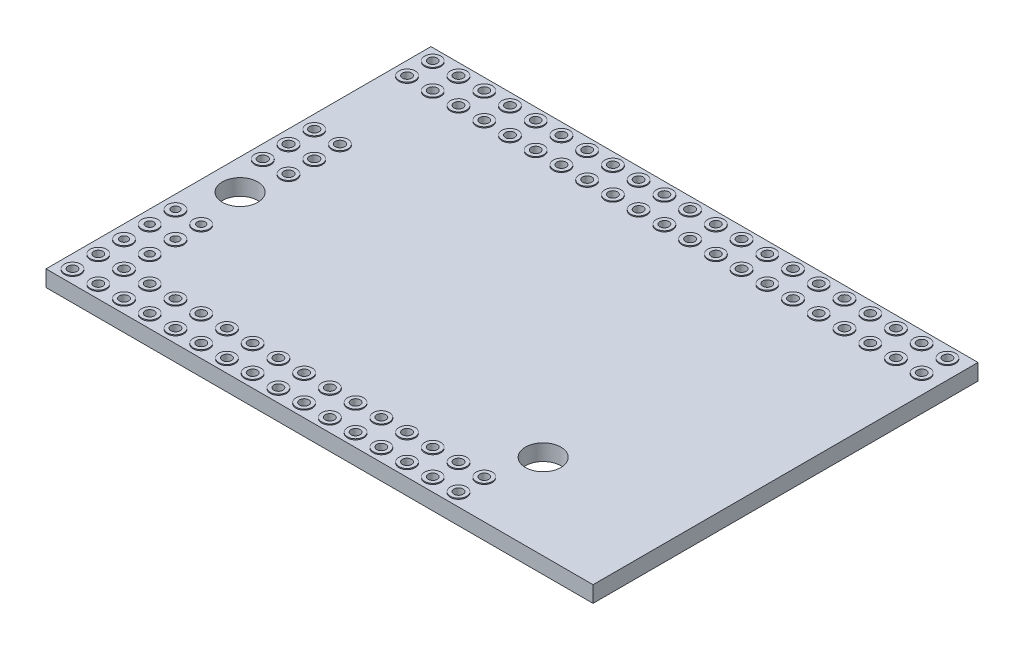
from build123d import *

# Parameters (mm, degrees)
SKETCH1_W                = 54
SKETCH1_H                = 38
BOSS_EXTRUDE1_DEPTH      = 1.6
SKETCH2_R                = 0.45
SKETCH2_R_2              = 0.394522512
SKETCH2_R_3              = 0.464048526
CUT_EXTRUDE1_DEPTH       = 34.053895383
SKETCH3_R                = 1.75
CUT_EXTRUDE2_DEPTH       = 34.053895383
BOSS_EXTRUDE2_DEPTH      = 0.1
BOSS_EXTRUDE2_DEPTH_BACK = 1.7
SKETCH4_R                = 0.8
SKETCH4_R_2              = 0.45
SKETCH4_R_3              = 0.464048526
SKETCH4_R_4              = 0.394522512


with BuildPart() as part:
    # Sketch1 → Boss-Extrude1 (new body)
    with BuildSketch(Plane(origin=(0, 0, 0), x_dir=(1, 0, 0), z_dir=(0, 1, 0))):
        Rectangle(SKETCH1_W, SKETCH1_H)
    extrude(amount=BOSS_EXTRUDE1_DEPTH)

    # Sketch2 → Cut-Extrude1 (cut, through all)
    with BuildSketch(Plane(origin=(0, 1.6, 0), x_dir=(1, 0, 0), z_dir=(0, 1, 0))):
        with Locations(Location((-25.6, -17.78, 0), (0, 0, 270))):
            Circle(SKETCH2_R)
        with Locations(Location((-23.06, -17.78, 0), (0, 0, 270))):
            Circle(SKETCH2_R)
        with Locations(Location((-20.52, -17.78, 0), (0, 0, 270))):
            Circle(SKETCH2_R)
        with Locations(Location((-17.98, -17.78, 0), (0, 0, 270))):
            Circle(SKETCH2_R)
        with Locations(Location((-15.44, -17.78, 0), (0, 0, 270))):
            Circle(SKETCH2_R)
        with Locations(Location((-12.9, -17.78, 0), (0, 0, 270))):
            Circle(SKETCH2_R)
        with Locations(Location((-10.36, -17.78, 0), (0, 0, 270))):
            Circle(SKETCH2_R)
        with Locations(Location((-7.82, -17.78, 0), (0, 0, 270))):
            Circle(SKETCH2_R)
        with Locations(Location((-5.28, -17.78, 0), (0, 0, 270))):
            Circle(SKETCH2_R)
        with Locations(Location((-2.74, -17.78, 0), (0, 0, 270))):
            Circle(SKETCH2_R)
        with Locations(Location((-0.2, -17.78, 0), (0, 0, 270))):
            Circle(SKETCH2_R)
        with Locations(Location((2.34, -17.78, 0), (0, 0, 270))):
            Circle(SKETCH2_R)
        with Locations(Location((4.88, -17.78, 0), (0, 0, 270))):
            Circle(SKETCH2_R)
        with Locations(Location((7.42, -17.78, 0), (0, 0, 270))):
            Circle(SKETCH2_R)
        with Locations(Location((9.96, -17.78, 0), (0, 0, 270))):
            Circle(SKETCH2_R)
        with Locations(Location((12.5, -17.78, 0), (0, 0, 270))):
            Circle(SKETCH2_R)
        with Locations(Location((-23.06, -15.24, 0), (0, 0, 270))):
            Circle(SKETCH2_R)
        with Locations(Location((-20.52, -15.24, 0), (0, 0, 270))):
            Circle(SKETCH2_R)
        with Locations(Location((-17.98, -15.24, 0), (0, 0, 270))):
            Circle(SKETCH2_R)
        with Locations(Location((-15.44, -15.24, 0), (0, 0, 270))):
            Circle(SKETCH2_R)
        with Locations(Location((-12.9, -15.24, 0), (0, 0, 270))):
            Circle(SKETCH2_R)
        with Locations(Location((-10.36, -15.24, 0), (0, 0, 270))):
            Circle(SKETCH2_R)
        with Locations(Location((-7.82, -15.24, 0), (0, 0, 270))):
            Circle(SKETCH2_R)
        with Locations(Location((-5.28, -15.24, 0), (0, 0, 270))):
            Circle(SKETCH2_R)
        with Locations(Location((-2.74, -15.24, 0), (0, 0, 270))):
            Circle(SKETCH2_R)
        with Locations(Location((-0.2, -15.24, 0), (0, 0, 270))):
            Circle(SKETCH2_R)
        with Locations(Location((2.34, -15.24, 0), (0, 0, 270))):
            Circle(SKETCH2_R)
        with Locations(Location((4.88, -15.24, 0), (0, 0, 270))):
            Circle(SKETCH2_R)
        with Locations(Location((7.42, -15.24, 0), (0, 0, 270))):
            Circle(SKETCH2_R)
        with Locations(Location((9.96, -15.24, 0), (0, 0, 270))):
            Circle(SKETCH2_R)
        with Locations(Location((12.5, -15.24, 0), (0, 0, 270))):
            Circle(SKETCH2_R)
        with Locations(Location((-25.6, -15.24, 0), (0, 0, 270))):
            Circle(SKETCH2_R)
        with Locations(Location((-25.6, 17.78, 0), (0, 0, 270))):
            Circle(SKETCH2_R)
        with Locations(Location((-23.06, 17.78, 0), (0, 0, 270))):
            Circle(SKETCH2_R)
        with Locations(Location((-20.52, 17.78, 0), (0, 0, 270))):
            Circle(SKETCH2_R)
        with Locations(Location((-17.98, 17.78, 0), (0, 0, 270))):
            Circle(SKETCH2_R)
        with Locations(Location((-15.44, 17.78, 0), (0, 0, 270))):
            Circle(SKETCH2_R)
        with Locations(Location((-12.9, 17.78, 0), (0, 0, 270))):
            Circle(SKETCH2_R)
        with Locations(Location((-10.36, 17.78, 0), (0, 0, 270))):
            Circle(SKETCH2_R)
        with Locations(Location((-7.82, 17.78, 0), (0, 0, 270))):
            Circle(SKETCH2_R)
        with Locations(Location((-5.28, 17.78, 0), (0, 0, 270))):
            Circle(SKETCH2_R)
        with Locations(Location((-2.74, 17.78, 0), (0, 0, 270))):
            Circle(SKETCH2_R)
        with Locations(Location((-0.2, 17.78, 0), (0, 0, 270))):
            Circle(SKETCH2_R)
        with Locations(Location((2.34, 17.78, 0), (0, 0, 270))):
            Circle(SKETCH2_R)
        with Locations(Location((4.88, 17.78, 0), (0, 0, 270))):
            Circle(SKETCH2_R)
        with Locations(Location((7.42, 17.78, 0), (0, 0, 270))):
            Circle(SKETCH2_R)
        with Locations(Location((9.96, 17.78, 0), (0, 0, 270))):
            Circle(SKETCH2_R)
        with Locations(Location((12.5, 17.78, 0), (0, 0, 270))):
            Circle(SKETCH2_R)
        with Locations(Location((15.04, 17.78, 0), (0, 0, 270))):
            Circle(SKETCH2_R)
        with Locations(Location((17.58, 17.78, 0), (0, 0, 270))):
            Circle(SKETCH2_R)
        with Locations(Location((20.12, 17.78, 0), (0, 0, 270))):
            Circle(SKETCH2_R)
        with Locations(Location((22.66, 17.78, 0), (0, 0, 270))):
            Circle(SKETCH2_R)
        with Locations(Location((25.2, 17.78, 0), (0, 0, 270))):
            Circle(SKETCH2_R)
        with Locations(Location((-23.06, 15.24, 0), (0, 0, 270))):
            Circle(SKETCH2_R)
        with Locations(Location((-20.52, 15.24, 0), (0, 0, 270))):
            Circle(SKETCH2_R)
        with Locations(Location((-17.98, 15.24, 0), (0, 0, 270))):
            Circle(SKETCH2_R)
        with Locations(Location((-15.44, 15.24, 0), (0, 0, 270))):
            Circle(SKETCH2_R)
        with Locations(Location((-12.9, 15.24, 0), (0, 0, 270))):
            Circle(SKETCH2_R)
        with Locations(Location((-10.36, 15.24, 0), (0, 0, 270))):
            Circle(SKETCH2_R)
        with Locations(Location((-7.82, 15.24, 0), (0, 0, 270))):
            Circle(SKETCH2_R)
        with Locations(Location((-5.28, 15.24, 0), (0, 0, 270))):
            Circle(SKETCH2_R)
        with Locations(Location((-2.74, 15.24, 0), (0, 0, 270))):
            Circle(SKETCH2_R)
        with Locations(Location((-0.2, 15.24, 0), (0, 0, 270))):
            Circle(SKETCH2_R)
        with Locations(Location((2.34, 15.24, 0), (0, 0, 270))):
            Circle(SKETCH2_R)
        with Locations(Location((4.88, 15.24, 0), (0, 0, 270))):
            Circle(SKETCH2_R)
        with Locations(Location((7.42, 15.24, 0), (0, 0, 270))):
            Circle(SKETCH2_R)
        with Locations(Location((9.96, 15.24, 0), (0, 0, 270))):
            Circle(SKETCH2_R)
        with Locations(Location((12.5, 15.24, 0), (0, 0, 270))):
            Circle(SKETCH2_R)
        with Locations(Location((15.04, 15.24, 0), (0, 0, 270))):
            Circle(SKETCH2_R)
        with Locations(Location((17.58, 15.24, 0), (0, 0, 270))):
            Circle(SKETCH2_R)
        with Locations(Location((20.12, 15.24, 0), (0, 0, 270))):
            Circle(SKETCH2_R)
        with Locations(Location((22.66, 15.24, 0), (0, 0, 270))):
            Circle(SKETCH2_R)
        with Locations(Location((25.2, 15.24, 0), (0, 0, 270))):
            Circle(SKETCH2_R)
        with Locations(Location((-25.6, 15.24, 0), (0, 0, 270))):
            Circle(SKETCH2_R)
        with Locations(Location((-25.6, -12.7, 0), (0, 0, 270))):
            Circle(SKETCH2_R_2)
        with Locations(Location((-23.06, -12.7, 0), (0, 0, 270))):
            Circle(SKETCH2_R_2)
        with Locations(Location((-23.06, -10.16, 0), (0, 0, 270))):
            Circle(SKETCH2_R_2)
        with Locations(Location((-23.06, -7.62, 0), (0, 0, 270))):
            Circle(SKETCH2_R_2)
        with Locations(Location((-25.6, -10.16, 0), (0, 0, 270))):
            Circle(SKETCH2_R_2)
        with Locations(Location((-25.6, -7.62, 0), (0, 0, 270))):
            Circle(SKETCH2_R_2)
        with Locations(Location((-25.6, 1, 0), (0, 0, 270))):
            Circle(SKETCH2_R_3)
        with Locations(Location((-23.06, 1, 0), (0, 0, 270))):
            Circle(SKETCH2_R_3)
        with Locations(Location((-23.06, 3.54, 0), (0, 0, 270))):
            Circle(SKETCH2_R_3)
        with Locations(Location((-23.06, 6.08, 0), (0, 0, 270))):
            Circle(SKETCH2_R_3)
        with Locations(Location((-25.6, 3.54, 0), (0, 0, 270))):
            Circle(SKETCH2_R_3)
        with Locations(Location((-25.6, 6.08, 0), (0, 0, 270))):
            Circle(SKETCH2_R_3)
    extrude(amount=-CUT_EXTRUDE1_DEPTH, mode=Mode.SUBTRACT)

    # Sketch3 → Cut-Extrude2 (cut, through all)
    with BuildSketch(Plane(origin=(0, 1.6, 0), x_dir=(1, 0, 0), z_dir=(0, 1, 0))):
        with Locations(Location((-23.98400997, -2.856152335, 0), (0, 0, 270))):
            Circle(SKETCH3_R)
        with Locations(Location((13.646874832, -10.571837349, 0), (0, 0, 270))):
            Circle(SKETCH3_R)
    extrude(amount=-CUT_EXTRUDE2_DEPTH, mode=Mode.SUBTRACT)

    # Sketch4 → Boss-Extrude2 (add, two sides: drawn at the far end of the back side and taken through both)
    # profile 1 of 86: a face of its own
    with BuildSketch(Plane(origin=(0, 1.6, 0), x_dir=(1, 0, 0), z_dir=(0, 1, 0)).offset(-BOSS_EXTRUDE2_DEPTH_BACK)):
        with Locations(Location((-25.6, 17.78, 0), (0, 0, 270))):
            Circle(SKETCH4_R)
        with Locations(Location((-25.6, 17.78, 0), (0, 0, 270))):
            Circle(SKETCH4_R_2, mode=Mode.SUBTRACT)
    # profile 2 of 86: a face of its own
    with BuildSketch(Plane(origin=(0, 1.6, 0), x_dir=(1, 0, 0), z_dir=(0, 1, 0)).offset(-BOSS_EXTRUDE2_DEPTH_BACK)):
        with Locations(Location((-23.06, 17.78, 0), (0, 0, 270))):
            Circle(SKETCH4_R)
        with Locations(Location((-23.06, 17.78, 0), (0, 0, 270))):
            Circle(SKETCH4_R_2, mode=Mode.SUBTRACT)
    # profile 3 of 86: a face of its own
    with BuildSketch(Plane(origin=(0, 1.6, 0), x_dir=(1, 0, 0), z_dir=(0, 1, 0)).offset(-BOSS_EXTRUDE2_DEPTH_BACK)):
        with Locations(Location((-20.52, 17.78, 0), (0, 0, 270))):
            Circle(SKETCH4_R)
        with Locations(Location((-20.52, 17.78, 0), (0, 0, 270))):
            Circle(SKETCH4_R_2, mode=Mode.SUBTRACT)
    # profile 4 of 86: a face of its own
    with BuildSketch(Plane(origin=(0, 1.6, 0), x_dir=(1, 0, 0), z_dir=(0, 1, 0)).offset(-BOSS_EXTRUDE2_DEPTH_BACK)):
        with Locations(Location((-17.98, 17.78, 0), (0, 0, 270))):
            Circle(SKETCH4_R)
        with Locations(Location((-17.98, 17.78, 0), (0, 0, 270))):
            Circle(SKETCH4_R_2, mode=Mode.SUBTRACT)
    # profile 5 of 86: a face of its own
    with BuildSketch(Plane(origin=(0, 1.6, 0), x_dir=(1, 0, 0), z_dir=(0, 1, 0)).offset(-BOSS_EXTRUDE2_DEPTH_BACK)):
        with Locations(Location((-15.44, 17.78, 0), (0, 0, 270))):
            Circle(SKETCH4_R)
        with Locations(Location((-15.44, 17.78, 0), (0, 0, 270))):
            Circle(SKETCH4_R_2, mode=Mode.SUBTRACT)
    # profile 6 of 86: a face of its own
    with BuildSketch(Plane(origin=(0, 1.6, 0), x_dir=(1, 0, 0), z_dir=(0, 1, 0)).offset(-BOSS_EXTRUDE2_DEPTH_BACK)):
        with Locations(Location((-12.9, 17.78, 0), (0, 0, 270))):
            Circle(SKETCH4_R)
        with Locations(Location((-12.9, 17.78, 0), (0, 0, 270))):
            Circle(SKETCH4_R_2, mode=Mode.SUBTRACT)
    # profile 7 of 86: a face of its own
    with BuildSketch(Plane(origin=(0, 1.6, 0), x_dir=(1, 0, 0), z_dir=(0, 1, 0)).offset(-BOSS_EXTRUDE2_DEPTH_BACK)):
        with Locations(Location((-10.36, 17.78, 0), (0, 0, 270))):
            Circle(SKETCH4_R)
        with Locations(Location((-10.36, 17.78, 0), (0, 0, 270))):
            Circle(SKETCH4_R_2, mode=Mode.SUBTRACT)
    # profile 8 of 86: a face of its own
    with BuildSketch(Plane(origin=(0, 1.6, 0), x_dir=(1, 0, 0), z_dir=(0, 1, 0)).offset(-BOSS_EXTRUDE2_DEPTH_BACK)):
        with Locations(Location((-7.82, 17.78, 0), (0, 0, 270))):
            Circle(SKETCH4_R)
        with Locations(Location((-7.82, 17.78, 0), (0, 0, 270))):
            Circle(SKETCH4_R_2, mode=Mode.SUBTRACT)
    # profile 9 of 86: a face of its own
    with BuildSketch(Plane(origin=(0, 1.6, 0), x_dir=(1, 0, 0), z_dir=(0, 1, 0)).offset(-BOSS_EXTRUDE2_DEPTH_BACK)):
        with Locations(Location((-5.28, 17.78, 0), (0, 0, 270))):
            Circle(SKETCH4_R)
        with Locations(Location((-5.28, 17.78, 0), (0, 0, 270))):
            Circle(SKETCH4_R_2, mode=Mode.SUBTRACT)
    # profile 10 of 86: a face of its own
    with BuildSketch(Plane(origin=(0, 1.6, 0), x_dir=(1, 0, 0), z_dir=(0, 1, 0)).offset(-BOSS_EXTRUDE2_DEPTH_BACK)):
        with Locations(Location((-2.74, 17.78, 0), (0, 0, 270))):
            Circle(SKETCH4_R)
        with Locations(Location((-2.74, 17.78, 0), (0, 0, 270))):
            Circle(SKETCH4_R_2, mode=Mode.SUBTRACT)
    # profile 11 of 86: a face of its own
    with BuildSketch(Plane(origin=(0, 1.6, 0), x_dir=(1, 0, 0), z_dir=(0, 1, 0)).offset(-BOSS_EXTRUDE2_DEPTH_BACK)):
        with Locations(Location((-0.2, 17.78, 0), (0, 0, 270))):
            Circle(SKETCH4_R)
        with Locations(Location((-0.2, 17.78, 0), (0, 0, 270))):
            Circle(SKETCH4_R_2, mode=Mode.SUBTRACT)
    # profile 12 of 86: a face of its own
    with BuildSketch(Plane(origin=(0, 1.6, 0), x_dir=(1, 0, 0), z_dir=(0, 1, 0)).offset(-BOSS_EXTRUDE2_DEPTH_BACK)):
        with Locations(Location((2.34, 17.78, 0), (0, 0, 270))):
            Circle(SKETCH4_R)
        with Locations(Location((2.34, 17.78, 0), (0, 0, 270))):
            Circle(SKETCH4_R_2, mode=Mode.SUBTRACT)
    # profile 13 of 86: a face of its own
    with BuildSketch(Plane(origin=(0, 1.6, 0), x_dir=(1, 0, 0), z_dir=(0, 1, 0)).offset(-BOSS_EXTRUDE2_DEPTH_BACK)):
        with Locations(Location((4.88, 17.78, 0), (0, 0, 270))):
            Circle(SKETCH4_R)
        with Locations(Location((4.88, 17.78, 0), (0, 0, 270))):
            Circle(SKETCH4_R_2, mode=Mode.SUBTRACT)
    # profile 14 of 86: a face of its own
    with BuildSketch(Plane(origin=(0, 1.6, 0), x_dir=(1, 0, 0), z_dir=(0, 1, 0)).offset(-BOSS_EXTRUDE2_DEPTH_BACK)):
        with Locations(Location((7.42, 17.78, 0), (0, 0, 270))):
            Circle(SKETCH4_R)
        with Locations(Location((7.42, 17.78, 0), (0, 0, 270))):
            Circle(SKETCH4_R_2, mode=Mode.SUBTRACT)
    # profile 15 of 86: a face of its own
    with BuildSketch(Plane(origin=(0, 1.6, 0), x_dir=(1, 0, 0), z_dir=(0, 1, 0)).offset(-BOSS_EXTRUDE2_DEPTH_BACK)):
        with Locations(Location((9.96, 17.78, 0), (0, 0, 270))):
            Circle(SKETCH4_R)
        with Locations(Location((9.96, 17.78, 0), (0, 0, 270))):
            Circle(SKETCH4_R_2, mode=Mode.SUBTRACT)
    # profile 16 of 86: a face of its own
    with BuildSketch(Plane(origin=(0, 1.6, 0), x_dir=(1, 0, 0), z_dir=(0, 1, 0)).offset(-BOSS_EXTRUDE2_DEPTH_BACK)):
        with Locations(Location((12.5, 17.78, 0), (0, 0, 270))):
            Circle(SKETCH4_R)
        with Locations(Location((12.5, 17.78, 0), (0, 0, 270))):
            Circle(SKETCH4_R_2, mode=Mode.SUBTRACT)
    # profile 17 of 86: a face of its own
    with BuildSketch(Plane(origin=(0, 1.6, 0), x_dir=(1, 0, 0), z_dir=(0, 1, 0)).offset(-BOSS_EXTRUDE2_DEPTH_BACK)):
        with Locations(Location((15.04, 17.78, 0), (0, 0, 270))):
            Circle(SKETCH4_R)
        with Locations(Location((15.04, 17.78, 0), (0, 0, 270))):
            Circle(SKETCH4_R_2, mode=Mode.SUBTRACT)
    # profile 18 of 86: a face of its own
    with BuildSketch(Plane(origin=(0, 1.6, 0), x_dir=(1, 0, 0), z_dir=(0, 1, 0)).offset(-BOSS_EXTRUDE2_DEPTH_BACK)):
        with Locations(Location((17.58, 17.78, 0), (0, 0, 270))):
            Circle(SKETCH4_R)
        with Locations(Location((17.58, 17.78, 0), (0, 0, 270))):
            Circle(SKETCH4_R_2, mode=Mode.SUBTRACT)
    # profile 19 of 86: a face of its own
    with BuildSketch(Plane(origin=(0, 1.6, 0), x_dir=(1, 0, 0), z_dir=(0, 1, 0)).offset(-BOSS_EXTRUDE2_DEPTH_BACK)):
        with Locations(Location((20.12, 17.78, 0), (0, 0, 270))):
            Circle(SKETCH4_R)
        with Locations(Location((20.12, 17.78, 0), (0, 0, 270))):
            Circle(SKETCH4_R_2, mode=Mode.SUBTRACT)
    # profile 20 of 86: a face of its own
    with BuildSketch(Plane(origin=(0, 1.6, 0), x_dir=(1, 0, 0), z_dir=(0, 1, 0)).offset(-BOSS_EXTRUDE2_DEPTH_BACK)):
        with Locations(Location((22.66, 17.78, 0), (0, 0, 270))):
            Circle(SKETCH4_R)
        with Locations(Location((22.66, 17.78, 0), (0, 0, 270))):
            Circle(SKETCH4_R_2, mode=Mode.SUBTRACT)
    # profile 21 of 86: a face of its own
    with BuildSketch(Plane(origin=(0, 1.6, 0), x_dir=(1, 0, 0), z_dir=(0, 1, 0)).offset(-BOSS_EXTRUDE2_DEPTH_BACK)):
        with Locations(Location((25.2, 17.78, 0), (0, 0, 270))):
            Circle(SKETCH4_R)
        with Locations(Location((25.2, 17.78, 0), (0, 0, 270))):
            Circle(SKETCH4_R_2, mode=Mode.SUBTRACT)
    # profile 22 of 86: a face of its own
    with BuildSketch(Plane(origin=(0, 1.6, 0), x_dir=(1, 0, 0), z_dir=(0, 1, 0)).offset(-BOSS_EXTRUDE2_DEPTH_BACK)):
        with Locations(Location((-23.06, 15.24, 0), (0, 0, 270))):
            Circle(SKETCH4_R)
        with Locations(Location((-23.06, 15.24, 0), (0, 0, 270))):
            Circle(SKETCH4_R_2, mode=Mode.SUBTRACT)
    # profile 23 of 86: a face of its own
    with BuildSketch(Plane(origin=(0, 1.6, 0), x_dir=(1, 0, 0), z_dir=(0, 1, 0)).offset(-BOSS_EXTRUDE2_DEPTH_BACK)):
        with Locations(Location((-20.52, 15.24, 0), (0, 0, 270))):
            Circle(SKETCH4_R)
        with Locations(Location((-20.52, 15.24, 0), (0, 0, 270))):
            Circle(SKETCH4_R_2, mode=Mode.SUBTRACT)
    # profile 24 of 86: a face of its own
    with BuildSketch(Plane(origin=(0, 1.6, 0), x_dir=(1, 0, 0), z_dir=(0, 1, 0)).offset(-BOSS_EXTRUDE2_DEPTH_BACK)):
        with Locations(Location((-17.98, 15.24, 0), (0, 0, 270))):
            Circle(SKETCH4_R)
        with Locations(Location((-17.98, 15.24, 0), (0, 0, 270))):
            Circle(SKETCH4_R_2, mode=Mode.SUBTRACT)
    # profile 25 of 86: a face of its own
    with BuildSketch(Plane(origin=(0, 1.6, 0), x_dir=(1, 0, 0), z_dir=(0, 1, 0)).offset(-BOSS_EXTRUDE2_DEPTH_BACK)):
        with Locations(Location((-15.44, 15.24, 0), (0, 0, 270))):
            Circle(SKETCH4_R)
        with Locations(Location((-15.44, 15.24, 0), (0, 0, 270))):
            Circle(SKETCH4_R_2, mode=Mode.SUBTRACT)
    # profile 26 of 86: a face of its own
    with BuildSketch(Plane(origin=(0, 1.6, 0), x_dir=(1, 0, 0), z_dir=(0, 1, 0)).offset(-BOSS_EXTRUDE2_DEPTH_BACK)):
        with Locations(Location((-12.9, 15.24, 0), (0, 0, 270))):
            Circle(SKETCH4_R)
        with Locations(Location((-12.9, 15.24, 0), (0, 0, 270))):
            Circle(SKETCH4_R_2, mode=Mode.SUBTRACT)
    # profile 27 of 86: a face of its own
    with BuildSketch(Plane(origin=(0, 1.6, 0), x_dir=(1, 0, 0), z_dir=(0, 1, 0)).offset(-BOSS_EXTRUDE2_DEPTH_BACK)):
        with Locations(Location((-10.36, 15.24, 0), (0, 0, 270))):
            Circle(SKETCH4_R)
        with Locations(Location((-10.36, 15.24, 0), (0, 0, 270))):
            Circle(SKETCH4_R_2, mode=Mode.SUBTRACT)
    # profile 28 of 86: a face of its own
    with BuildSketch(Plane(origin=(0, 1.6, 0), x_dir=(1, 0, 0), z_dir=(0, 1, 0)).offset(-BOSS_EXTRUDE2_DEPTH_BACK)):
        with Locations(Location((-7.82, 15.24, 0), (0, 0, 270))):
            Circle(SKETCH4_R)
        with Locations(Location((-7.82, 15.24, 0), (0, 0, 270))):
            Circle(SKETCH4_R_2, mode=Mode.SUBTRACT)
    # profile 29 of 86: a face of its own
    with BuildSketch(Plane(origin=(0, 1.6, 0), x_dir=(1, 0, 0), z_dir=(0, 1, 0)).offset(-BOSS_EXTRUDE2_DEPTH_BACK)):
        with Locations(Location((-5.28, 15.24, 0), (0, 0, 270))):
            Circle(SKETCH4_R)
        with Locations(Location((-5.28, 15.24, 0), (0, 0, 270))):
            Circle(SKETCH4_R_2, mode=Mode.SUBTRACT)
    # profile 30 of 86: a face of its own
    with BuildSketch(Plane(origin=(0, 1.6, 0), x_dir=(1, 0, 0), z_dir=(0, 1, 0)).offset(-BOSS_EXTRUDE2_DEPTH_BACK)):
        with Locations(Location((-2.74, 15.24, 0), (0, 0, 270))):
            Circle(SKETCH4_R)
        with Locations(Location((-2.74, 15.24, 0), (0, 0, 270))):
            Circle(SKETCH4_R_2, mode=Mode.SUBTRACT)
    # profile 31 of 86: a face of its own
    with BuildSketch(Plane(origin=(0, 1.6, 0), x_dir=(1, 0, 0), z_dir=(0, 1, 0)).offset(-BOSS_EXTRUDE2_DEPTH_BACK)):
        with Locations(Location((-0.2, 15.24, 0), (0, 0, 270))):
            Circle(SKETCH4_R)
        with Locations(Location((-0.2, 15.24, 0), (0, 0, 270))):
            Circle(SKETCH4_R_2, mode=Mode.SUBTRACT)
    # profile 32 of 86: a face of its own
    with BuildSketch(Plane(origin=(0, 1.6, 0), x_dir=(1, 0, 0), z_dir=(0, 1, 0)).offset(-BOSS_EXTRUDE2_DEPTH_BACK)):
        with Locations(Location((2.34, 15.24, 0), (0, 0, 270))):
            Circle(SKETCH4_R)
        with Locations(Location((2.34, 15.24, 0), (0, 0, 270))):
            Circle(SKETCH4_R_2, mode=Mode.SUBTRACT)
    # profile 33 of 86: a face of its own
    with BuildSketch(Plane(origin=(0, 1.6, 0), x_dir=(1, 0, 0), z_dir=(0, 1, 0)).offset(-BOSS_EXTRUDE2_DEPTH_BACK)):
        with Locations(Location((4.88, 15.24, 0), (0, 0, 270))):
            Circle(SKETCH4_R)
        with Locations(Location((4.88, 15.24, 0), (0, 0, 270))):
            Circle(SKETCH4_R_2, mode=Mode.SUBTRACT)
    # profile 34 of 86: a face of its own
    with BuildSketch(Plane(origin=(0, 1.6, 0), x_dir=(1, 0, 0), z_dir=(0, 1, 0)).offset(-BOSS_EXTRUDE2_DEPTH_BACK)):
        with Locations(Location((7.42, 15.24, 0), (0, 0, 270))):
            Circle(SKETCH4_R)
        with Locations(Location((7.42, 15.24, 0), (0, 0, 270))):
            Circle(SKETCH4_R_2, mode=Mode.SUBTRACT)
    # profile 35 of 86: a face of its own
    with BuildSketch(Plane(origin=(0, 1.6, 0), x_dir=(1, 0, 0), z_dir=(0, 1, 0)).offset(-BOSS_EXTRUDE2_DEPTH_BACK)):
        with Locations(Location((9.96, 15.24, 0), (0, 0, 270))):
            Circle(SKETCH4_R)
        with Locations(Location((9.96, 15.24, 0), (0, 0, 270))):
            Circle(SKETCH4_R_2, mode=Mode.SUBTRACT)
    # profile 36 of 86: a face of its own
    with BuildSketch(Plane(origin=(0, 1.6, 0), x_dir=(1, 0, 0), z_dir=(0, 1, 0)).offset(-BOSS_EXTRUDE2_DEPTH_BACK)):
        with Locations(Location((12.5, 15.24, 0), (0, 0, 270))):
            Circle(SKETCH4_R)
        with Locations(Location((12.5, 15.24, 0), (0, 0, 270))):
            Circle(SKETCH4_R_2, mode=Mode.SUBTRACT)
    # profile 37 of 86: a face of its own
    with BuildSketch(Plane(origin=(0, 1.6, 0), x_dir=(1, 0, 0), z_dir=(0, 1, 0)).offset(-BOSS_EXTRUDE2_DEPTH_BACK)):
        with Locations(Location((15.04, 15.24, 0), (0, 0, 270))):
            Circle(SKETCH4_R)
        with Locations(Location((15.04, 15.24, 0), (0, 0, 270))):
            Circle(SKETCH4_R_2, mode=Mode.SUBTRACT)
    # profile 38 of 86: a face of its own
    with BuildSketch(Plane(origin=(0, 1.6, 0), x_dir=(1, 0, 0), z_dir=(0, 1, 0)).offset(-BOSS_EXTRUDE2_DEPTH_BACK)):
        with Locations(Location((17.58, 15.24, 0), (0, 0, 270))):
            Circle(SKETCH4_R)
        with Locations(Location((17.58, 15.24, 0), (0, 0, 270))):
            Circle(SKETCH4_R_2, mode=Mode.SUBTRACT)
    # profile 39 of 86: a face of its own
    with BuildSketch(Plane(origin=(0, 1.6, 0), x_dir=(1, 0, 0), z_dir=(0, 1, 0)).offset(-BOSS_EXTRUDE2_DEPTH_BACK)):
        with Locations(Location((20.12, 15.24, 0), (0, 0, 270))):
            Circle(SKETCH4_R)
        with Locations(Location((20.12, 15.24, 0), (0, 0, 270))):
            Circle(SKETCH4_R_2, mode=Mode.SUBTRACT)
    # profile 40 of 86: a face of its own
    with BuildSketch(Plane(origin=(0, 1.6, 0), x_dir=(1, 0, 0), z_dir=(0, 1, 0)).offset(-BOSS_EXTRUDE2_DEPTH_BACK)):
        with Locations(Location((22.66, 15.24, 0), (0, 0, 270))):
            Circle(SKETCH4_R)
        with Locations(Location((22.66, 15.24, 0), (0, 0, 270))):
            Circle(SKETCH4_R_2, mode=Mode.SUBTRACT)
    # profile 41 of 86: a face of its own
    with BuildSketch(Plane(origin=(0, 1.6, 0), x_dir=(1, 0, 0), z_dir=(0, 1, 0)).offset(-BOSS_EXTRUDE2_DEPTH_BACK)):
        with Locations(Location((25.2, 15.24, 0), (0, 0, 270))):
            Circle(SKETCH4_R)
        with Locations(Location((25.2, 15.24, 0), (0, 0, 270))):
            Circle(SKETCH4_R_2, mode=Mode.SUBTRACT)
    # profile 42 of 86: a face of its own
    with BuildSketch(Plane(origin=(0, 1.6, 0), x_dir=(1, 0, 0), z_dir=(0, 1, 0)).offset(-BOSS_EXTRUDE2_DEPTH_BACK)):
        with Locations(Location((-25.6, 15.24, 0), (0, 0, 270))):
            Circle(SKETCH4_R)
        with Locations(Location((-25.6, 15.24, 0), (0, 0, 270))):
            Circle(SKETCH4_R_2, mode=Mode.SUBTRACT)
    # profile 43 of 86: a face of its own
    with BuildSketch(Plane(origin=(0, 1.6, 0), x_dir=(1, 0, 0), z_dir=(0, 1, 0)).offset(-BOSS_EXTRUDE2_DEPTH_BACK)):
        with Locations(Location((-25.6, -17.78, 0), (0, 0, 270))):
            Circle(SKETCH4_R)
        with Locations(Location((-25.6, -17.78, 0), (0, 0, 270))):
            Circle(SKETCH4_R_2, mode=Mode.SUBTRACT)
    # profile 44 of 86: a face of its own
    with BuildSketch(Plane(origin=(0, 1.6, 0), x_dir=(1, 0, 0), z_dir=(0, 1, 0)).offset(-BOSS_EXTRUDE2_DEPTH_BACK)):
        with Locations(Location((-23.06, -17.78, 0), (0, 0, 270))):
            Circle(SKETCH4_R)
        with Locations(Location((-23.06, -17.78, 0), (0, 0, 270))):
            Circle(SKETCH4_R_2, mode=Mode.SUBTRACT)
    # profile 45 of 86: a face of its own
    with BuildSketch(Plane(origin=(0, 1.6, 0), x_dir=(1, 0, 0), z_dir=(0, 1, 0)).offset(-BOSS_EXTRUDE2_DEPTH_BACK)):
        with Locations(Location((-20.52, -17.78, 0), (0, 0, 270))):
            Circle(SKETCH4_R)
        with Locations(Location((-20.52, -17.78, 0), (0, 0, 270))):
            Circle(SKETCH4_R_2, mode=Mode.SUBTRACT)
    # profile 46 of 86: a face of its own
    with BuildSketch(Plane(origin=(0, 1.6, 0), x_dir=(1, 0, 0), z_dir=(0, 1, 0)).offset(-BOSS_EXTRUDE2_DEPTH_BACK)):
        with Locations(Location((-17.98, -17.78, 0), (0, 0, 270))):
            Circle(SKETCH4_R)
        with Locations(Location((-17.98, -17.78, 0), (0, 0, 270))):
            Circle(SKETCH4_R_2, mode=Mode.SUBTRACT)
    # profile 47 of 86: a face of its own
    with BuildSketch(Plane(origin=(0, 1.6, 0), x_dir=(1, 0, 0), z_dir=(0, 1, 0)).offset(-BOSS_EXTRUDE2_DEPTH_BACK)):
        with Locations(Location((-15.44, -17.78, 0), (0, 0, 270))):
            Circle(SKETCH4_R)
        with Locations(Location((-15.44, -17.78, 0), (0, 0, 270))):
            Circle(SKETCH4_R_2, mode=Mode.SUBTRACT)
    # profile 48 of 86: a face of its own
    with BuildSketch(Plane(origin=(0, 1.6, 0), x_dir=(1, 0, 0), z_dir=(0, 1, 0)).offset(-BOSS_EXTRUDE2_DEPTH_BACK)):
        with Locations(Location((-12.9, -17.78, 0), (0, 0, 270))):
            Circle(SKETCH4_R)
        with Locations(Location((-12.9, -17.78, 0), (0, 0, 270))):
            Circle(SKETCH4_R_2, mode=Mode.SUBTRACT)
    # profile 49 of 86: a face of its own
    with BuildSketch(Plane(origin=(0, 1.6, 0), x_dir=(1, 0, 0), z_dir=(0, 1, 0)).offset(-BOSS_EXTRUDE2_DEPTH_BACK)):
        with Locations(Location((-10.36, -17.78, 0), (0, 0, 270))):
            Circle(SKETCH4_R)
        with Locations(Location((-10.36, -17.78, 0), (0, 0, 270))):
            Circle(SKETCH4_R_2, mode=Mode.SUBTRACT)
    # profile 50 of 86: a face of its own
    with BuildSketch(Plane(origin=(0, 1.6, 0), x_dir=(1, 0, 0), z_dir=(0, 1, 0)).offset(-BOSS_EXTRUDE2_DEPTH_BACK)):
        with Locations(Location((-7.82, -17.78, 0), (0, 0, 270))):
            Circle(SKETCH4_R)
        with Locations(Location((-7.82, -17.78, 0), (0, 0, 270))):
            Circle(SKETCH4_R_2, mode=Mode.SUBTRACT)
    # profile 51 of 86: a face of its own
    with BuildSketch(Plane(origin=(0, 1.6, 0), x_dir=(1, 0, 0), z_dir=(0, 1, 0)).offset(-BOSS_EXTRUDE2_DEPTH_BACK)):
        with Locations(Location((-5.28, -17.78, 0), (0, 0, 270))):
            Circle(SKETCH4_R)
        with Locations(Location((-5.28, -17.78, 0), (0, 0, 270))):
            Circle(SKETCH4_R_2, mode=Mode.SUBTRACT)
    # profile 52 of 86: a face of its own
    with BuildSketch(Plane(origin=(0, 1.6, 0), x_dir=(1, 0, 0), z_dir=(0, 1, 0)).offset(-BOSS_EXTRUDE2_DEPTH_BACK)):
        with Locations(Location((-2.74, -17.78, 0), (0, 0, 270))):
            Circle(SKETCH4_R)
        with Locations(Location((-2.74, -17.78, 0), (0, 0, 270))):
            Circle(SKETCH4_R_2, mode=Mode.SUBTRACT)
    # profile 53 of 86: a face of its own
    with BuildSketch(Plane(origin=(0, 1.6, 0), x_dir=(1, 0, 0), z_dir=(0, 1, 0)).offset(-BOSS_EXTRUDE2_DEPTH_BACK)):
        with Locations(Location((-0.2, -17.78, 0), (0, 0, 270))):
            Circle(SKETCH4_R)
        with Locations(Location((-0.2, -17.78, 0), (0, 0, 270))):
            Circle(SKETCH4_R_2, mode=Mode.SUBTRACT)
    # profile 54 of 86: a face of its own
    with BuildSketch(Plane(origin=(0, 1.6, 0), x_dir=(1, 0, 0), z_dir=(0, 1, 0)).offset(-BOSS_EXTRUDE2_DEPTH_BACK)):
        with Locations(Location((2.34, -17.78, 0), (0, 0, 270))):
            Circle(SKETCH4_R)
        with Locations(Location((2.34, -17.78, 0), (0, 0, 270))):
            Circle(SKETCH4_R_2, mode=Mode.SUBTRACT)
    # profile 55 of 86: a face of its own
    with BuildSketch(Plane(origin=(0, 1.6, 0), x_dir=(1, 0, 0), z_dir=(0, 1, 0)).offset(-BOSS_EXTRUDE2_DEPTH_BACK)):
        with Locations(Location((4.88, -17.78, 0), (0, 0, 270))):
            Circle(SKETCH4_R)
        with Locations(Location((4.88, -17.78, 0), (0, 0, 270))):
            Circle(SKETCH4_R_2, mode=Mode.SUBTRACT)
    # profile 56 of 86: a face of its own
    with BuildSketch(Plane(origin=(0, 1.6, 0), x_dir=(1, 0, 0), z_dir=(0, 1, 0)).offset(-BOSS_EXTRUDE2_DEPTH_BACK)):
        with Locations(Location((7.42, -17.78, 0), (0, 0, 270))):
            Circle(SKETCH4_R)
        with Locations(Location((7.42, -17.78, 0), (0, 0, 270))):
            Circle(SKETCH4_R_2, mode=Mode.SUBTRACT)
    # profile 57 of 86: a face of its own
    with BuildSketch(Plane(origin=(0, 1.6, 0), x_dir=(1, 0, 0), z_dir=(0, 1, 0)).offset(-BOSS_EXTRUDE2_DEPTH_BACK)):
        with Locations(Location((9.96, -17.78, 0), (0, 0, 270))):
            Circle(SKETCH4_R)
        with Locations(Location((9.96, -17.78, 0), (0, 0, 270))):
            Circle(SKETCH4_R_2, mode=Mode.SUBTRACT)
    # profile 58 of 86: a face of its own
    with BuildSketch(Plane(origin=(0, 1.6, 0), x_dir=(1, 0, 0), z_dir=(0, 1, 0)).offset(-BOSS_EXTRUDE2_DEPTH_BACK)):
        with Locations(Location((12.5, -17.78, 0), (0, 0, 270))):
            Circle(SKETCH4_R)
        with Locations(Location((12.5, -17.78, 0), (0, 0, 270))):
            Circle(SKETCH4_R_2, mode=Mode.SUBTRACT)
    # profile 59 of 86: a face of its own
    with BuildSketch(Plane(origin=(0, 1.6, 0), x_dir=(1, 0, 0), z_dir=(0, 1, 0)).offset(-BOSS_EXTRUDE2_DEPTH_BACK)):
        with Locations(Location((-23.06, -15.24, 0), (0, 0, 270))):
            Circle(SKETCH4_R)
        with Locations(Location((-23.06, -15.24, 0), (0, 0, 270))):
            Circle(SKETCH4_R_2, mode=Mode.SUBTRACT)
    # profile 60 of 86: a face of its own
    with BuildSketch(Plane(origin=(0, 1.6, 0), x_dir=(1, 0, 0), z_dir=(0, 1, 0)).offset(-BOSS_EXTRUDE2_DEPTH_BACK)):
        with Locations(Location((-20.52, -15.24, 0), (0, 0, 270))):
            Circle(SKETCH4_R)
        with Locations(Location((-20.52, -15.24, 0), (0, 0, 270))):
            Circle(SKETCH4_R_2, mode=Mode.SUBTRACT)
    # profile 61 of 86: a face of its own
    with BuildSketch(Plane(origin=(0, 1.6, 0), x_dir=(1, 0, 0), z_dir=(0, 1, 0)).offset(-BOSS_EXTRUDE2_DEPTH_BACK)):
        with Locations(Location((-17.98, -15.24, 0), (0, 0, 270))):
            Circle(SKETCH4_R)
        with Locations(Location((-17.98, -15.24, 0), (0, 0, 270))):
            Circle(SKETCH4_R_2, mode=Mode.SUBTRACT)
    # profile 62 of 86: a face of its own
    with BuildSketch(Plane(origin=(0, 1.6, 0), x_dir=(1, 0, 0), z_dir=(0, 1, 0)).offset(-BOSS_EXTRUDE2_DEPTH_BACK)):
        with Locations(Location((-15.44, -15.24, 0), (0, 0, 270))):
            Circle(SKETCH4_R)
        with Locations(Location((-15.44, -15.24, 0), (0, 0, 270))):
            Circle(SKETCH4_R_2, mode=Mode.SUBTRACT)
    # profile 63 of 86: a face of its own
    with BuildSketch(Plane(origin=(0, 1.6, 0), x_dir=(1, 0, 0), z_dir=(0, 1, 0)).offset(-BOSS_EXTRUDE2_DEPTH_BACK)):
        with Locations(Location((-12.9, -15.24, 0), (0, 0, 270))):
            Circle(SKETCH4_R)
        with Locations(Location((-12.9, -15.24, 0), (0, 0, 270))):
            Circle(SKETCH4_R_2, mode=Mode.SUBTRACT)
    # profile 64 of 86: a face of its own
    with BuildSketch(Plane(origin=(0, 1.6, 0), x_dir=(1, 0, 0), z_dir=(0, 1, 0)).offset(-BOSS_EXTRUDE2_DEPTH_BACK)):
        with Locations(Location((-10.36, -15.24, 0), (0, 0, 270))):
            Circle(SKETCH4_R)
        with Locations(Location((-10.36, -15.24, 0), (0, 0, 270))):
            Circle(SKETCH4_R_2, mode=Mode.SUBTRACT)
    # profile 65 of 86: a face of its own
    with BuildSketch(Plane(origin=(0, 1.6, 0), x_dir=(1, 0, 0), z_dir=(0, 1, 0)).offset(-BOSS_EXTRUDE2_DEPTH_BACK)):
        with Locations(Location((-7.82, -15.24, 0), (0, 0, 270))):
            Circle(SKETCH4_R)
        with Locations(Location((-7.82, -15.24, 0), (0, 0, 270))):
            Circle(SKETCH4_R_2, mode=Mode.SUBTRACT)
    # profile 66 of 86: a face of its own
    with BuildSketch(Plane(origin=(0, 1.6, 0), x_dir=(1, 0, 0), z_dir=(0, 1, 0)).offset(-BOSS_EXTRUDE2_DEPTH_BACK)):
        with Locations(Location((-5.28, -15.24, 0), (0, 0, 270))):
            Circle(SKETCH4_R)
        with Locations(Location((-5.28, -15.24, 0), (0, 0, 270))):
            Circle(SKETCH4_R_2, mode=Mode.SUBTRACT)
    # profile 67 of 86: a face of its own
    with BuildSketch(Plane(origin=(0, 1.6, 0), x_dir=(1, 0, 0), z_dir=(0, 1, 0)).offset(-BOSS_EXTRUDE2_DEPTH_BACK)):
        with Locations(Location((-2.74, -15.24, 0), (0, 0, 270))):
            Circle(SKETCH4_R)
        with Locations(Location((-2.74, -15.24, 0), (0, 0, 270))):
            Circle(SKETCH4_R_2, mode=Mode.SUBTRACT)
    # profile 68 of 86: a face of its own
    with BuildSketch(Plane(origin=(0, 1.6, 0), x_dir=(1, 0, 0), z_dir=(0, 1, 0)).offset(-BOSS_EXTRUDE2_DEPTH_BACK)):
        with Locations(Location((-0.2, -15.24, 0), (0, 0, 270))):
            Circle(SKETCH4_R)
        with Locations(Location((-0.2, -15.24, 0), (0, 0, 270))):
            Circle(SKETCH4_R_2, mode=Mode.SUBTRACT)
    # profile 69 of 86: a face of its own
    with BuildSketch(Plane(origin=(0, 1.6, 0), x_dir=(1, 0, 0), z_dir=(0, 1, 0)).offset(-BOSS_EXTRUDE2_DEPTH_BACK)):
        with Locations(Location((2.34, -15.24, 0), (0, 0, 270))):
            Circle(SKETCH4_R)
        with Locations(Location((2.34, -15.24, 0), (0, 0, 270))):
            Circle(SKETCH4_R_2, mode=Mode.SUBTRACT)
    # profile 70 of 86: a face of its own
    with BuildSketch(Plane(origin=(0, 1.6, 0), x_dir=(1, 0, 0), z_dir=(0, 1, 0)).offset(-BOSS_EXTRUDE2_DEPTH_BACK)):
        with Locations(Location((4.88, -15.24, 0), (0, 0, 270))):
            Circle(SKETCH4_R)
        with Locations(Location((4.88, -15.24, 0), (0, 0, 270))):
            Circle(SKETCH4_R_2, mode=Mode.SUBTRACT)
    # profile 71 of 86: a face of its own
    with BuildSketch(Plane(origin=(0, 1.6, 0), x_dir=(1, 0, 0), z_dir=(0, 1, 0)).offset(-BOSS_EXTRUDE2_DEPTH_BACK)):
        with Locations(Location((7.42, -15.24, 0), (0, 0, 270))):
            Circle(SKETCH4_R)
        with Locations(Location((7.42, -15.24, 0), (0, 0, 270))):
            Circle(SKETCH4_R_2, mode=Mode.SUBTRACT)
    # profile 72 of 86: a face of its own
    with BuildSketch(Plane(origin=(0, 1.6, 0), x_dir=(1, 0, 0), z_dir=(0, 1, 0)).offset(-BOSS_EXTRUDE2_DEPTH_BACK)):
        with Locations(Location((9.96, -15.24, 0), (0, 0, 270))):
            Circle(SKETCH4_R)
        with Locations(Location((9.96, -15.24, 0), (0, 0, 270))):
            Circle(SKETCH4_R_2, mode=Mode.SUBTRACT)
    # profile 73 of 86: a face of its own
    with BuildSketch(Plane(origin=(0, 1.6, 0), x_dir=(1, 0, 0), z_dir=(0, 1, 0)).offset(-BOSS_EXTRUDE2_DEPTH_BACK)):
        with Locations(Location((12.5, -15.24, 0), (0, 0, 270))):
            Circle(SKETCH4_R)
        with Locations(Location((12.5, -15.24, 0), (0, 0, 270))):
            Circle(SKETCH4_R_2, mode=Mode.SUBTRACT)
    # profile 74 of 86: a face of its own
    with BuildSketch(Plane(origin=(0, 1.6, 0), x_dir=(1, 0, 0), z_dir=(0, 1, 0)).offset(-BOSS_EXTRUDE2_DEPTH_BACK)):
        with Locations(Location((-25.6, -15.24, 0), (0, 0, 270))):
            Circle(SKETCH4_R)
        with Locations(Location((-25.6, -15.24, 0), (0, 0, 270))):
            Circle(SKETCH4_R_2, mode=Mode.SUBTRACT)
    # profile 75 of 86: a face of its own
    with BuildSketch(Plane(origin=(0, 1.6, 0), x_dir=(1, 0, 0), z_dir=(0, 1, 0)).offset(-BOSS_EXTRUDE2_DEPTH_BACK)):
        with Locations(Location((-25.6, 6.08, 0), (0, 0, 270))):
            Circle(SKETCH4_R)
        with Locations(Location((-25.6, 6.08, 0), (0, 0, 270))):
            Circle(SKETCH4_R_3, mode=Mode.SUBTRACT)
    # profile 76 of 86: a face of its own
    with BuildSketch(Plane(origin=(0, 1.6, 0), x_dir=(1, 0, 0), z_dir=(0, 1, 0)).offset(-BOSS_EXTRUDE2_DEPTH_BACK)):
        with Locations(Location((-25.6, -7.62, 0), (0, 0, 270))):
            Circle(SKETCH4_R)
        with Locations(Location((-25.6, -7.62, 0), (0, 0, 270))):
            Circle(SKETCH4_R_4, mode=Mode.SUBTRACT)
    # profile 77 of 86: a face of its own
    with BuildSketch(Plane(origin=(0, 1.6, 0), x_dir=(1, 0, 0), z_dir=(0, 1, 0)).offset(-BOSS_EXTRUDE2_DEPTH_BACK)):
        with Locations(Location((-23.06, 6.08, 0), (0, 0, 270))):
            Circle(SKETCH4_R)
        with Locations(Location((-23.06, 6.08, 0), (0, 0, 270))):
            Circle(SKETCH4_R_3, mode=Mode.SUBTRACT)
    # profile 78 of 86: a face of its own
    with BuildSketch(Plane(origin=(0, 1.6, 0), x_dir=(1, 0, 0), z_dir=(0, 1, 0)).offset(-BOSS_EXTRUDE2_DEPTH_BACK)):
        with Locations(Location((-23.06, -7.62, 0), (0, 0, 270))):
            Circle(SKETCH4_R)
        with Locations(Location((-23.06, -7.62, 0), (0, 0, 270))):
            Circle(SKETCH4_R_4, mode=Mode.SUBTRACT)
    # profile 79 of 86: a face of its own
    with BuildSketch(Plane(origin=(0, 1.6, 0), x_dir=(1, 0, 0), z_dir=(0, 1, 0)).offset(-BOSS_EXTRUDE2_DEPTH_BACK)):
        with Locations(Location((-23.06, 3.54, 0), (0, 0, 270))):
            Circle(SKETCH4_R)
        with Locations(Location((-23.06, 3.54, 0), (0, 0, 270))):
            Circle(SKETCH4_R_3, mode=Mode.SUBTRACT)
    # profile 80 of 86: a face of its own
    with BuildSketch(Plane(origin=(0, 1.6, 0), x_dir=(1, 0, 0), z_dir=(0, 1, 0)).offset(-BOSS_EXTRUDE2_DEPTH_BACK)):
        with Locations(Location((-23.06, -10.16, 0), (0, 0, 270))):
            Circle(SKETCH4_R)
        with Locations(Location((-23.06, -10.16, 0), (0, 0, 270))):
            Circle(SKETCH4_R_4, mode=Mode.SUBTRACT)
    # profile 81 of 86: a face of its own
    with BuildSketch(Plane(origin=(0, 1.6, 0), x_dir=(1, 0, 0), z_dir=(0, 1, 0)).offset(-BOSS_EXTRUDE2_DEPTH_BACK)):
        with Locations(Location((-23.06, 1, 0), (0, 0, 270))):
            Circle(SKETCH4_R)
        with Locations(Location((-23.06, 1, 0), (0, 0, 270))):
            Circle(SKETCH4_R_3, mode=Mode.SUBTRACT)
    # profile 82 of 86: a face of its own
    with BuildSketch(Plane(origin=(0, 1.6, 0), x_dir=(1, 0, 0), z_dir=(0, 1, 0)).offset(-BOSS_EXTRUDE2_DEPTH_BACK)):
        with Locations(Location((-23.06, -12.7, 0), (0, 0, 270))):
            Circle(SKETCH4_R)
        with Locations(Location((-23.06, -12.7, 0), (0, 0, 270))):
            Circle(SKETCH4_R_4, mode=Mode.SUBTRACT)
    # profile 83 of 86: a face of its own
    with BuildSketch(Plane(origin=(0, 1.6, 0), x_dir=(1, 0, 0), z_dir=(0, 1, 0)).offset(-BOSS_EXTRUDE2_DEPTH_BACK)):
        with Locations(Location((-25.6, 3.54, 0), (0, 0, 270))):
            Circle(SKETCH4_R)
        with Locations(Location((-25.6, 3.54, 0), (0, 0, 270))):
            Circle(SKETCH4_R_3, mode=Mode.SUBTRACT)
    # profile 84 of 86: a face of its own
    with BuildSketch(Plane(origin=(0, 1.6, 0), x_dir=(1, 0, 0), z_dir=(0, 1, 0)).offset(-BOSS_EXTRUDE2_DEPTH_BACK)):
        with Locations(Location((-25.6, -10.16, 0), (0, 0, 270))):
            Circle(SKETCH4_R)
        with Locations(Location((-25.6, -10.16, 0), (0, 0, 270))):
            Circle(SKETCH4_R_4, mode=Mode.SUBTRACT)
    # profile 85 of 86: a face of its own
    with BuildSketch(Plane(origin=(0, 1.6, 0), x_dir=(1, 0, 0), z_dir=(0, 1, 0)).offset(-BOSS_EXTRUDE2_DEPTH_BACK)):
        with Locations(Location((-25.6, 1, 0), (0, 0, 270))):
            Circle(SKETCH4_R)
        with Locations(Location((-25.6, 1, 0), (0, 0, 270))):
            Circle(SKETCH4_R_3, mode=Mode.SUBTRACT)
    # profile 86 of 86: a face of its own
    with BuildSketch(Plane(origin=(0, 1.6, 0), x_dir=(1, 0, 0), z_dir=(0, 1, 0)).offset(-BOSS_EXTRUDE2_DEPTH_BACK)):
        with Locations(Location((-25.6, -12.7, 0), (0, 0, 270))):
            Circle(SKETCH4_R)
        with Locations(Location((-25.6, -12.7, 0), (0, 0, 270))):
            Circle(SKETCH4_R_4, mode=Mode.SUBTRACT)
    extrude(amount=BOSS_EXTRUDE2_DEPTH + BOSS_EXTRUDE2_DEPTH_BACK)


solid = part.part
